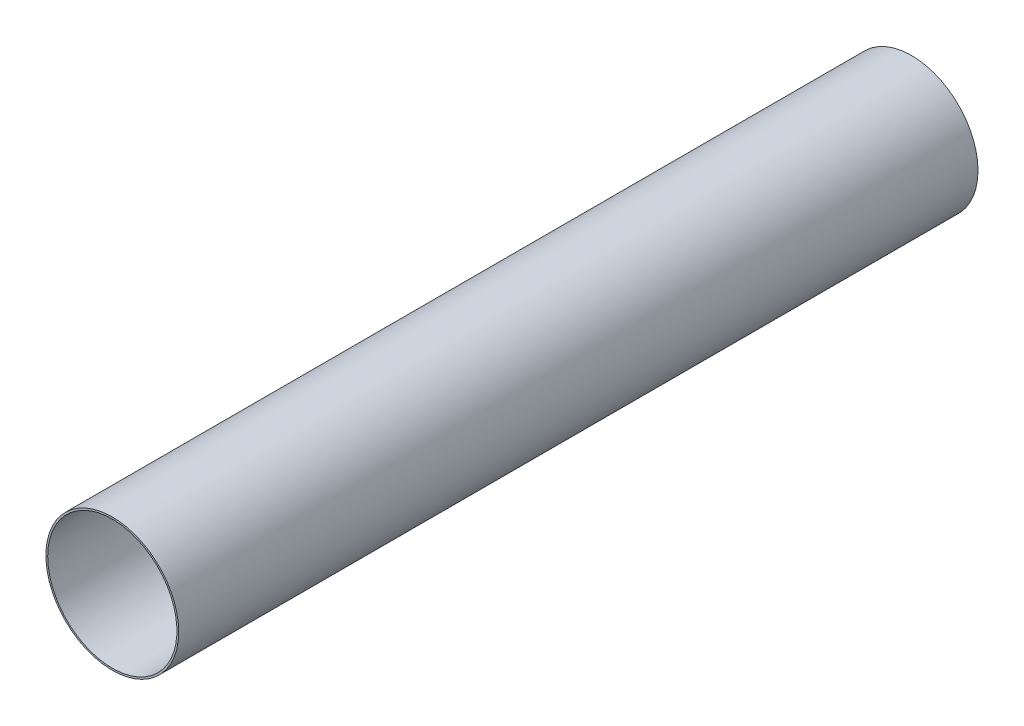
from build123d import *

# Parameters (mm, degrees)
SKETCH2_R           = 46.6725
BOSS_EXTRUDE1_DEPTH = 561.6448
SKETCH3_R           = 45.4025
CUT_EXTRUDE1_DEPTH  = 566.509969744


with BuildPart() as part:
    # Sketch2 → Boss-Extrude1 (new body)
    with BuildSketch(Plane.XY):
        Circle(SKETCH2_R)
    extrude(amount=BOSS_EXTRUDE1_DEPTH)

    # Sketch3 → Cut-Extrude1 (cut, through all)
    with BuildSketch(Plane(origin=(0, 0, 0), x_dir=(-1, 0, 0), z_dir=(0, 0, -1))):
        Circle(SKETCH3_R)
    extrude(amount=-CUT_EXTRUDE1_DEPTH, mode=Mode.SUBTRACT)


solid = part.part
